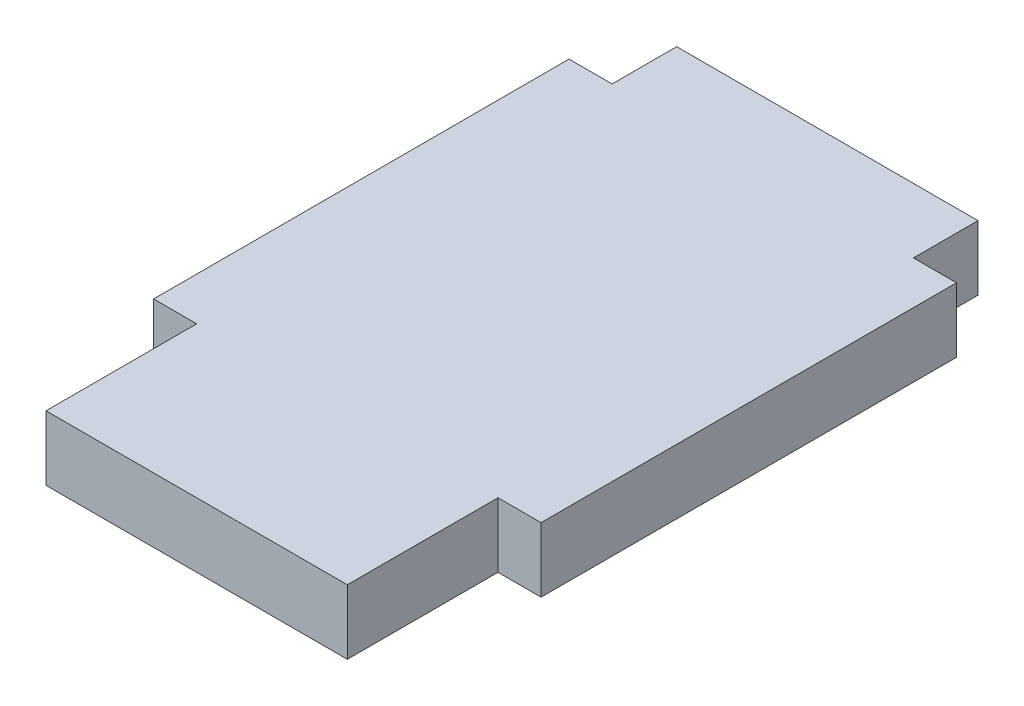
from build123d import *

# Parameters (mm, degrees)
EXTRUDE_1_DEPTH = 3
SKETCH_3_W      = 14
SKETCH_3_H      = 3
EXTRUDE_2_DEPTH = 4


with BuildPart() as part:
    # Эскиз1 → Бобышка-Вытянуть1 (new body)
    with BuildSketch(Plane(origin=(0, 0, 0), x_dir=(1, 0, 0), z_dir=(0, 1, 0))):
        Polygon((-9, -10.434482278), (-9, 8.865517722), (-7, 8.865517722), (-7, 11.865517722), (7, 11.865517722), (7, 8.865517722), (9, 8.865517722), (9, -10.434482278), (7, -10.434482278), (7, -13.434482278), (-7, -13.434482278), (-7, -10.434482278), align=None)
    extrude(amount=EXTRUDE_1_DEPTH)

    # Эскиз3 → Бобышка-Вытянуть2 (add)
    with BuildSketch(Plane.XY.offset(13.434482278)):
        with Locations((0, 1.5)):
            Rectangle(SKETCH_3_W, SKETCH_3_H)
    extrude(amount=EXTRUDE_2_DEPTH)


solid = part.part
